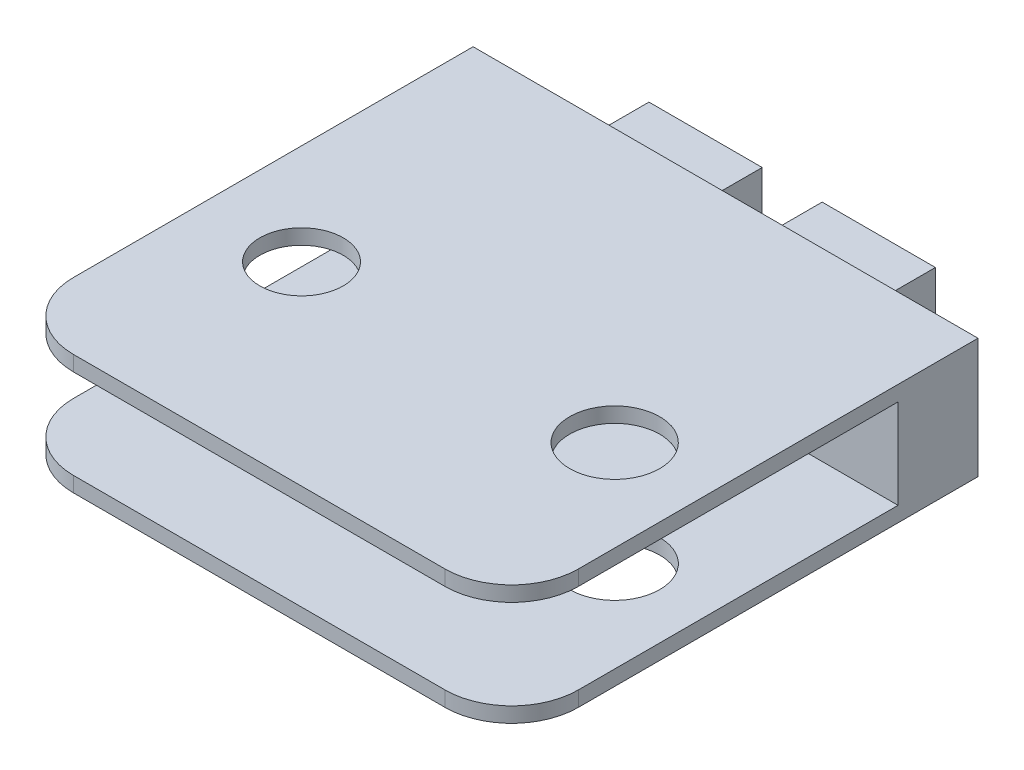
from build123d import *

# Parameters (mm, degrees)
SKETCH1_W           = 75.79
SKETCH1_H           = 18
BOSS_EXTRUDE1_DEPTH = 60
SKETCH2_W           = 75.79
SKETCH2_H           = 13.45
CUT_EXTRUDE1_DEPTH  = 58
SKETCH7_R           = 6.260869565
SKETCH7_R_2         = 6.760869565
CUT_EXTRUDE3_DEPTH  = 74.212232755
SKETCH6_W           = 75.79
SKETCH6_H           = 18
BOSS_EXTRUDE2_DEPTH = 10
SKETCH8_W           = 17
SKETCH8_H           = 10
BOSS_EXTRUDE3_DEPTH = 10
FILLET1_R           = 10


with BuildPart() as part:
    # Sketch1 → Boss-Extrude1 (new body)
    with BuildSketch(Plane.XY):
        Rectangle(SKETCH1_W, SKETCH1_H)
    extrude(amount=BOSS_EXTRUDE1_DEPTH)

    # Sketch2 → Cut-Extrude1 (cut)
    with BuildSketch(Plane.XY.offset(60)):
        Rectangle(SKETCH2_W, SKETCH2_H)
    extrude(amount=-CUT_EXTRUDE1_DEPTH, mode=Mode.SUBTRACT)

    # Sketch7 → Cut-Extrude3 (cut, through all)
    with BuildSketch(Plane(origin=(0, 9, 0), x_dir=(1, 0, 0), z_dir=(0, 1, 0))):
        with Locations(Location((-22.807801707, -30.844118328, 0), (0, 0, 270))):
            Circle(SKETCH7_R)
        with Locations(Location((24.199095104, -30.844118328, 0), (0, 0, 270))):
            Circle(SKETCH7_R_2)
    extrude(amount=-CUT_EXTRUDE3_DEPTH, mode=Mode.SUBTRACT)

    # Sketch6 → Boss-Extrude2 (add)
    with BuildSketch(Plane(origin=(0, 0, 0), x_dir=(-1, 0, 0), z_dir=(0, 0, -1))):
        Rectangle(SKETCH6_W, SKETCH6_H)
    extrude(amount=BOSS_EXTRUDE2_DEPTH)

    # Sketch8 → Boss-Extrude3 (add)
    with BuildSketch(Plane(origin=(0, 0, -10), x_dir=(-1, 0, 0), z_dir=(0, 0, -1))):
        with Locations((-13, 0)):
            Rectangle(SKETCH8_W, SKETCH8_H)
        with Locations((13, 0)):
            Rectangle(SKETCH8_W, SKETCH8_H)
    extrude(amount=BOSS_EXTRUDE3_DEPTH)

    # Fillet1
    fillet1_edges = [part.edges().sort_by_distance(p)[0] for p in [
        (-37.895, 7.8625, 60),
        (37.895, 7.8625, 60),
        (-37.895, -7.8625, 60),
        (37.895, -7.8625, 60),
    ]]
    fillet(fillet1_edges, radius=FILLET1_R)


solid = part.part
